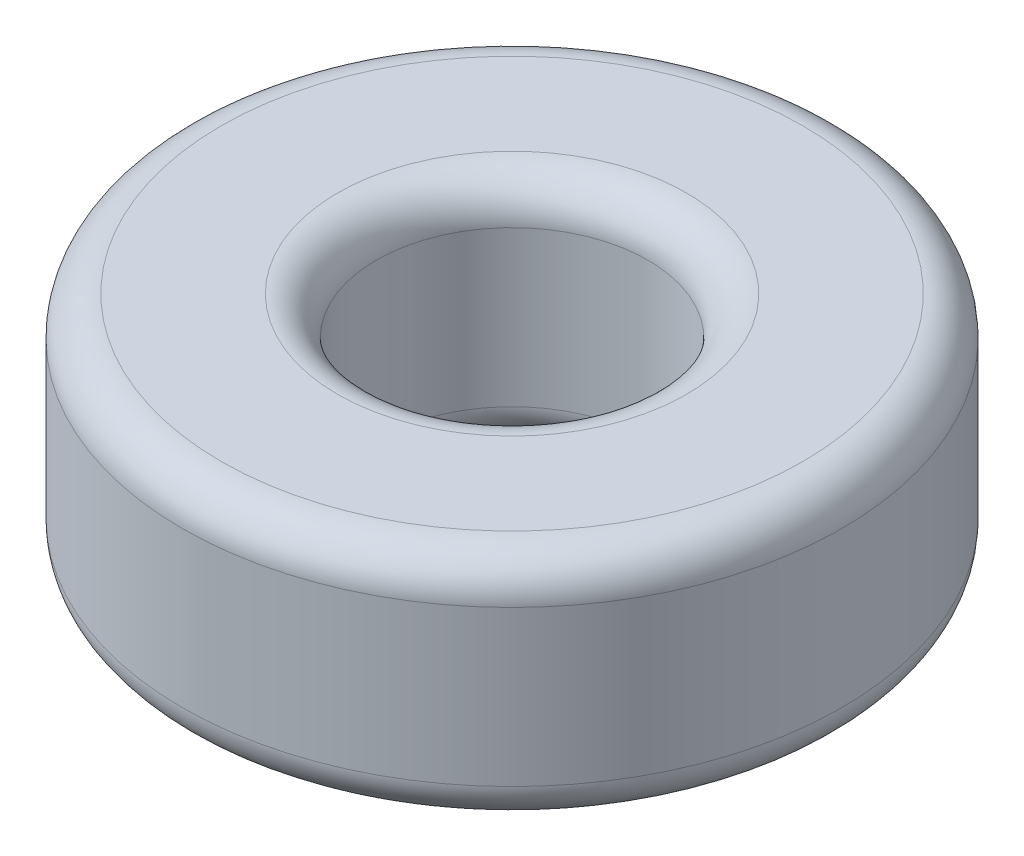
from build123d import *

# Parameters (mm, degrees)
SKETCH_1_R      = 8.5
SKETCH_1_R_2    = 3.5
EXTRUDE_1_DEPTH = 6
FILLET_1_R      = 1
FILLET_2_R      = 1


with BuildPart() as part:
    # 草圖1 → 填料-伸長1 (new body)
    with BuildSketch(Plane(origin=(0, 0, 0), x_dir=(1, 0, 0), z_dir=(0, 1, 0))):
        with Locations(Location((0, 0, 0), (0, 0, 270))):
            Circle(SKETCH_1_R)
        with Locations(Location((0, 0, 0), (0, 0, 270))):
            Circle(SKETCH_1_R_2, mode=Mode.SUBTRACT)
    extrude(amount=EXTRUDE_1_DEPTH)

    # 圓角1
    fillet_1_edges = [part.edges().sort_by_distance(p)[0] for p in [
        (0, 6, -8.5),
        (0, 0, -3.5),
        (0, 6, -3.5),
    ]]
    fillet(fillet_1_edges, radius=FILLET_1_R)

    # 圓角2
    fillet_2_edges = [part.edges().sort_by_distance(p)[0] for p in [
        (0, 0, -8.5),
    ]]
    fillet(fillet_2_edges, radius=FILLET_2_R)


solid = part.part
